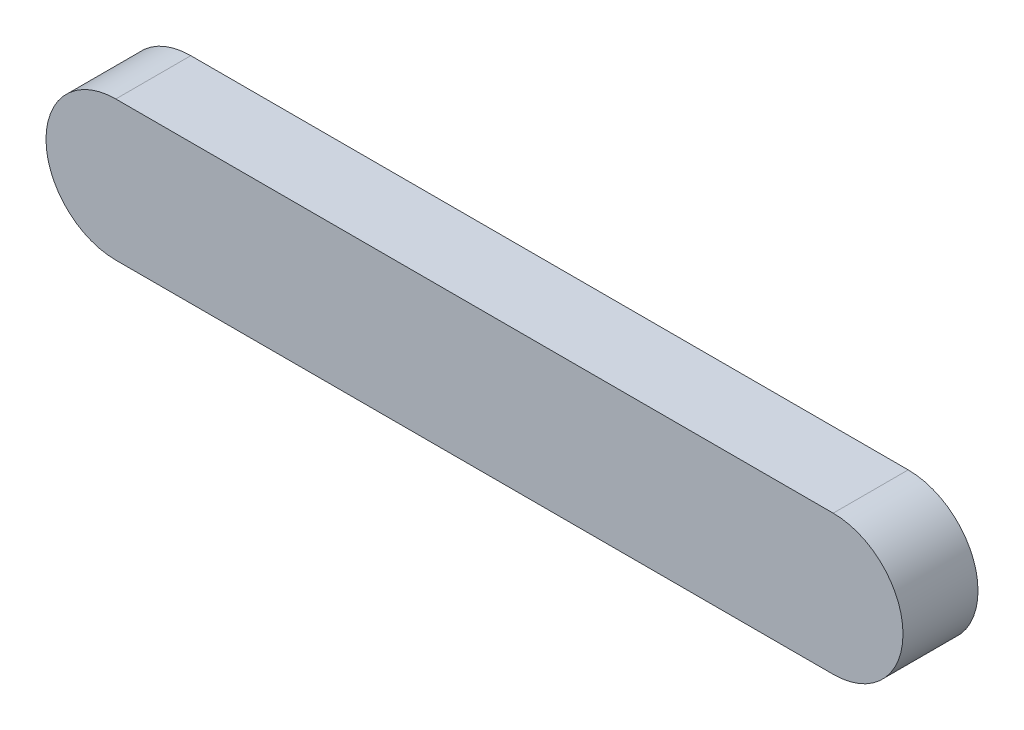
from build123d import *

# Parameters (mm, degrees)
BOSS_EXTRUDE1_DEPTH = 10


with BuildPart() as part:
    # Sketch1 → Boss-Extrude1 (new body)
    with BuildSketch(Plane.XY):
        with BuildLine():
            Line((41.116857141, -9.305393984), (-54.533936839, -9.305393984))
            ThreePointArc((-54.533936839, -9.305393984), (-63.839330824, 0), (-54.533936839, 9.305393984))
            Line((-54.533936839, 9.305393984), (41.116857141, 9.305393984))
            ThreePointArc((41.116857141, 9.305393984), (50.422251125, 0), (41.116857141, -9.305393984))
        make_face()
    extrude(amount=BOSS_EXTRUDE1_DEPTH)


solid = part.part
